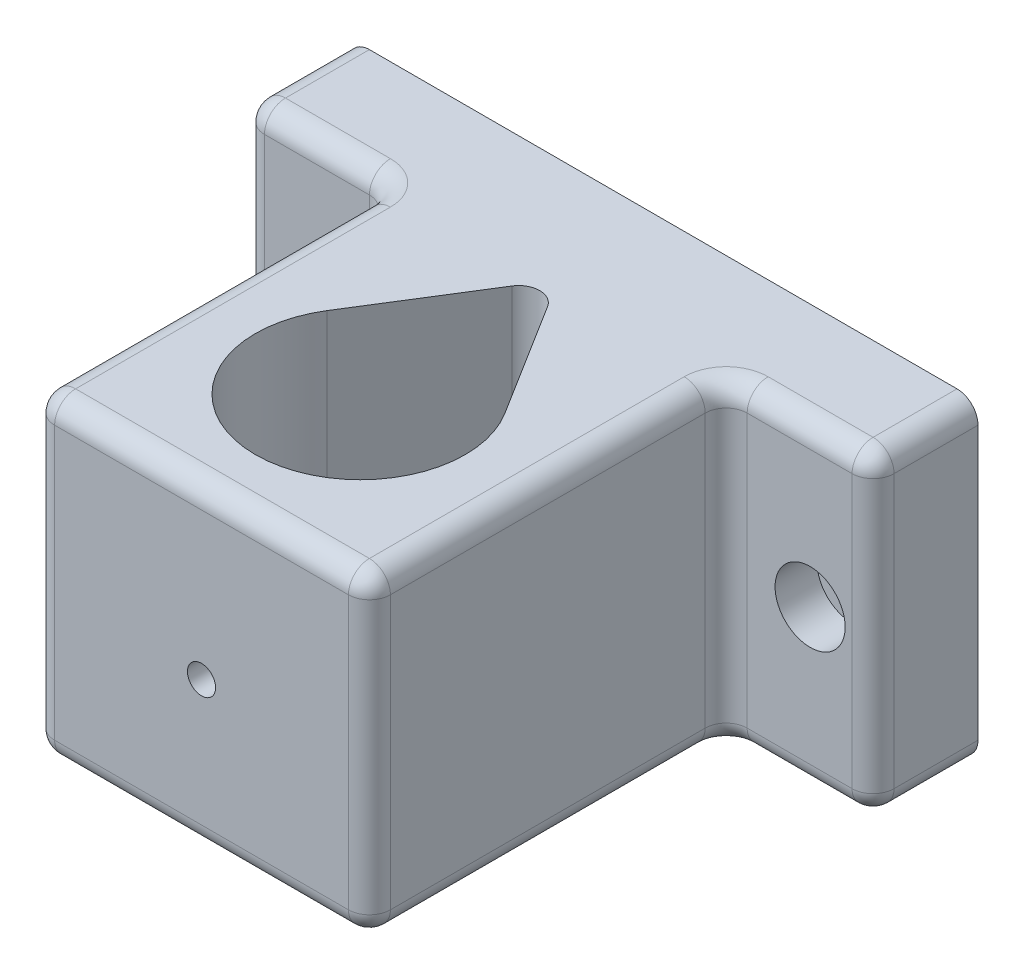
from build123d import *

# Parameters (mm, degrees)
SKETCH1_W                        = 38.1
SKETCH1_H                        = 19.05
BOSS_EXTRUDE1_DEPTH              = 27.94
SKETCH2_W                        = 8.89
SKETCH2_H                        = 19.05
CUT_EXTRUDE1_DEPTH               = 21.59
CUT_EXTRUDE2_DEPTH               = 31.75
F_43_0_089_DIAMETER_HOLE1_D      = 2.2606
F_51_0_067_DIAMETER_HOLE1_REACH  = 52.943
F_51_0_067_DIAMETER_HOLE1_BORE_R = 0.8509
FILLET1_R                        = 1.27
SKETCH11_R                       = 2.75
CUT_EXTRUDE3_DEPTH               = 2
SKETCH12_R                       = 2.159
SKETCH12_R_2                     = 2.1209
CUT_EXTRUDE4_DEPTH               = 2.54


with BuildPart() as part:
    # Sketch1 → Boss-Extrude1 (new body)
    with BuildSketch(Plane.XY):
        with Locations((19.05, 9.525)):
            Rectangle(SKETCH1_W, SKETCH1_H)
    extrude(amount=BOSS_EXTRUDE1_DEPTH)

    # Sketch2 → Cut-Extrude1 (cut)
    with BuildSketch(Plane.XY.offset(27.94)):
        with Locations((4.445, 9.525)):
            Rectangle(SKETCH2_W, SKETCH2_H)
        with Locations((33.655, 9.525)):
            Rectangle(SKETCH2_W, SKETCH2_H)
    extrude(amount=-CUT_EXTRUDE1_DEPTH, mode=Mode.SUBTRACT)

    # Sketch4 → Cut-Extrude2 (cut)
    with BuildSketch(Plane(origin=(0, 19.05, 0), x_dir=(1, 0, 0), z_dir=(0, 1, 0))):
        with BuildLine():
            Line((13.66521077, -14.965662769), (19.05, -6.35))
            Line((19.05, -6.35), (24.43478923, -14.965662769))
            ThreePointArc((24.43478923, -14.965662769), (19.05, -24.681156038), (13.66521077, -14.965662769))
        make_face()
    extrude(amount=-CUT_EXTRUDE2_DEPTH, mode=Mode.SUBTRACT)

    # #43 (0.089) Diameter Hole1 (through all)
    with Locations(Plane.XY.offset(6.35)):
        with Locations((3.81, 9.525), (34.29, 9.525)):
            Hole(F_43_0_089_DIAMETER_HOLE1_D / 2)

    # #51 (0.067) Diameter Hole1 bore → #51 (0.067) Diameter Hole1 (cut, up to next)
    with BuildSketch(Plane.XY.offset(27.94), mode=Mode.PRIVATE) as f_51_0_067_diameter_hole1_sk1:
        with Locations((19.05, 8.89)):
            Circle(F_51_0_067_DIAMETER_HOLE1_BORE_R)
    f_51_0_067_diameter_hole1_tool1 = extrude(f_51_0_067_diameter_hole1_sk1.sketch, amount=-F_51_0_067_DIAMETER_HOLE1_REACH, mode=Mode.PRIVATE) & part.part
    add(f_51_0_067_diameter_hole1_tool1.solids().sort_by_distance((19.05, 8.89, 27.94))[0], mode=Mode.SUBTRACT)

    # Fillet1
    fillet1_edges = [part.edges().sort_by_distance(p)[0] for p in [
        (19.05, 0, 27.94),
        (0, 19.05, 3.175),
        (0, 0, 3.175),
        (0, 9.525, 6.35),
        (4.445, 19.05, 6.35),
        (8.89, 9.525, 6.35),
        (8.89, 19.05, 17.145),
        (4.445, 0, 6.35),
        (8.89, 0, 17.145),
        (8.89, 9.525, 27.94),
        (19.05, 19.05, 27.94),
        (38.1, 19.05, 3.175),
        (38.1, 0, 3.175),
        (38.1, 9.525, 6.35),
        (33.655, 0, 6.35),
        (29.21, 9.525, 6.35),
        (29.21, 0, 17.145),
        (33.655, 19.05, 6.35),
        (29.21, 19.05, 17.145),
        (29.21, 9.525, 27.94),
        (19.05, 9.525, 6.35),
    ]]
    fillet(fillet1_edges, radius=FILLET1_R)

    # Sketch11 → Cut-Extrude3 (cut)
    with BuildSketch(Plane(origin=(0, 0, 0), x_dir=(-1, 0, 0), z_dir=(0, 0, -1))):
        with Locations((-19.05, 9.525)):
            Circle(SKETCH11_R)
    extrude(amount=-CUT_EXTRUDE3_DEPTH, mode=Mode.SUBTRACT)

    # Sketch12 → Cut-Extrude4 (cut)
    with BuildSketch(Plane.XY.offset(6.35)):
        with Locations((3.81, 9.525)):
            Circle(SKETCH12_R)
        with Locations((34.29, 9.525)):
            Circle(SKETCH12_R_2)
    extrude(amount=-CUT_EXTRUDE4_DEPTH, mode=Mode.SUBTRACT)


solid = part.part
